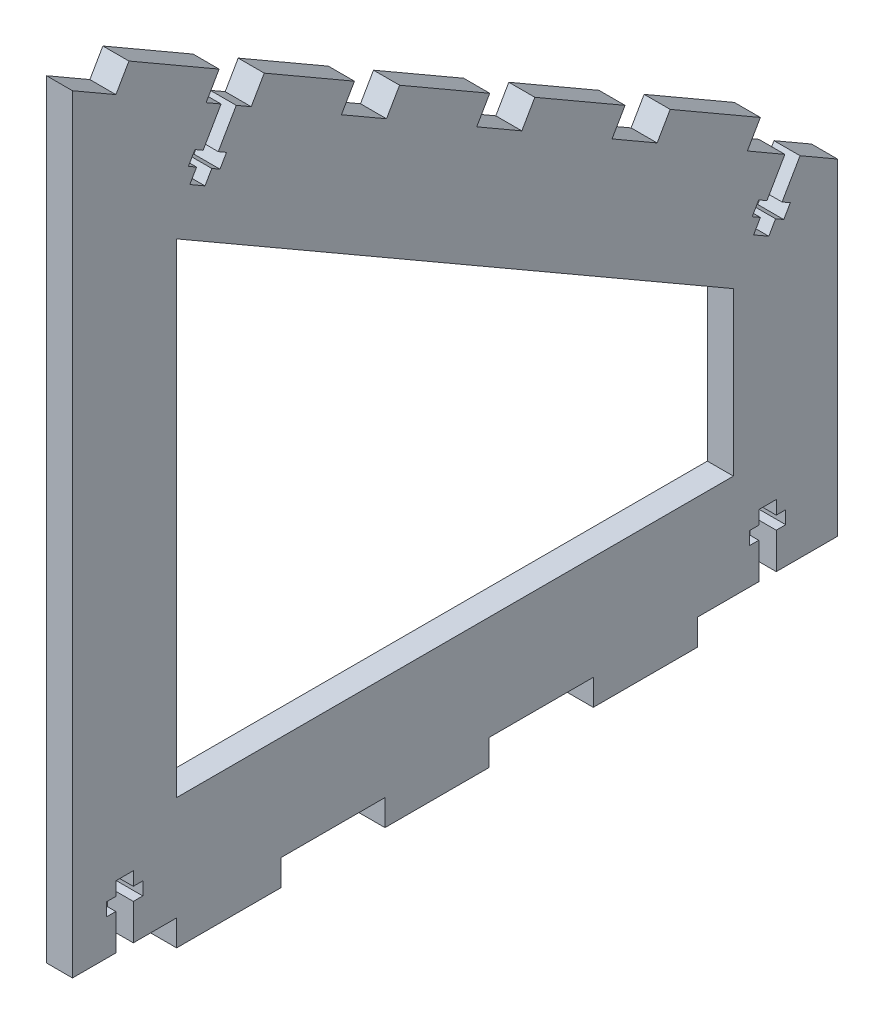
from build123d import *

# Parameters (mm, degrees)
BOSS_EXTRUDE1_DEPTH = 3.175
CUT_EXTRUDE1_DEPTH  = 6.35
SKETCH3_W           = 6.35
SKETCH3_H           = 25.4
BOSS_EXTRUDE2_DEPTH = 6.35
LPATTERN1_COUNT     = 5
LPATTERN1_PITCH     = 38.1
SKETCH4_W           = 6.35
SKETCH4_H           = 25.4
BOSS_EXTRUDE3_DEPTH = 6.35
LPATTERN2_COUNT     = 3
LPATTERN2_PITCH     = 50.8
CUT_EXTRUDE2_DEPTH  = 6.35
CUT_EXTRUDE3_DEPTH  = 6.35


with BuildPart() as part:
    # Sketch1 → Boss-Extrude1 (new, symmetric)
    with BuildSketch(Plane.ZY.offset(32.038437852)):
        Polygon((-215.9, 95.25), (-215.9, 174.9125), (-29.333338138, 282.626812448), (-29.333338138, 95.25), align=None)
    extrude(amount=BOSS_EXTRUDE1_DEPTH, both=True)

    # Sketch2 → Cut-Extrude1 (cut)
    with BuildSketch(Plane.ZY.offset(35.213437852)):
        Polygon((-190.5, 160.247803163), (-190.5, 120.65), (-54.733338138, 120.65), (-54.733338138, 238.632721936), align=None)
    extrude(amount=-CUT_EXTRUDE1_DEPTH, mode=Mode.SUBTRACT)

    # Sketch3 → Boss-Extrude2 (add)
    with BuildSketch(Plane(origin=(0, 224.671817339, -129.71433422), x_dir=(1, 0, 0), z_dir=(0, 0.8660254037844386, -0.5000000000000001))):
        with Locations((-32.038437852, 61.418634677)):
            Rectangle(SKETCH3_W, SKETCH3_H)
    boss_extrude2 = extrude(amount=BOSS_EXTRUDE2_DEPTH)

    # LPattern1: Boss-Extrude2 ×5
    with Locations(*[Vector(1.0927391974657063e-15, 0.5000000000000003, 0.8660254037844386) * (i * LPATTERN1_PITCH) for i in range(1, LPATTERN1_COUNT)]):
        add(boss_extrude2)

    # Sketch4 → Boss-Extrude3 (add)
    with BuildSketch(Plane.XZ.offset(-95.25)):
        with Locations((-32.038437852, -67.433338138)):
            Rectangle(SKETCH4_W, SKETCH4_H)
    boss_extrude3 = extrude(amount=BOSS_EXTRUDE3_DEPTH)

    # LPattern2: Boss-Extrude3 ×3
    with Locations(*[(0, 0, -i * LPATTERN2_PITCH) for i in range(1, LPATTERN2_COUNT)]):
        add(boss_extrude3)

    # Sketch5 → Cut-Extrude2 (cut)
    with BuildSketch(Plane(origin=(-28.863437852, 0, 0), x_dir=(0, 0, -1), z_dir=(1, 0, 0))):
        Polygon((196.683069069, 95.25), (200.950269069, 95.25), (200.950269069, 104.013), (203.261669069, 104.013), (203.261669069, 107.188), (200.950269069, 107.188), (200.950269069, 110.49), (196.683069069, 110.49), (196.683069069, 107.188), (194.371669069, 107.188), (194.371669069, 104.013), (196.683069069, 104.013), align=None)
        Polygon((39.899738138, 95.25), (44.166938138, 95.25), (44.166938138, 104.013), (46.478338138, 104.013), (46.478338138, 107.188), (44.166938138, 107.188), (44.166938138, 110.49), (39.899738138, 110.49), (39.899738138, 107.188), (37.588338138, 107.188), (37.588338138, 104.013), (39.899738138, 104.013), align=None)
    extrude(amount=-CUT_EXTRUDE2_DEPTH, mode=Mode.SUBTRACT)

    # Sketch6 → Cut-Extrude3 (cut)
    with BuildSketch(Plane(origin=(-28.863437852, 0, 0), x_dir=(0, 0, -1), z_dir=(1, 0, 0))):
        Polygon((206.749229173, 180.1957), (203.05372557, 182.3293), (198.67222557, 174.740319387), (196.670494452, 175.896019387), (195.082994452, 173.14638873), (197.08472557, 171.99068873), (195.43372557, 169.131072846), (199.129229173, 166.997472846), (200.780229173, 169.85708873), (202.781960292, 168.70138873), (204.369460292, 171.451019387), (202.367729173, 172.606719387), align=None)
        Polygon((69.267696323, 259.5707), (65.57219272, 261.7043), (61.19069272, 254.115319387), (59.188961601, 255.271019387), (57.601461601, 252.52138873), (59.60319272, 251.36568873), (57.95219272, 248.506072846), (61.647696323, 246.372472846), (63.298696323, 249.23208873), (65.300427441, 248.07638873), (66.887927441, 250.826019387), (64.886196323, 251.981719387), align=None)
    extrude(amount=-CUT_EXTRUDE3_DEPTH, mode=Mode.SUBTRACT)


solid = part.part
